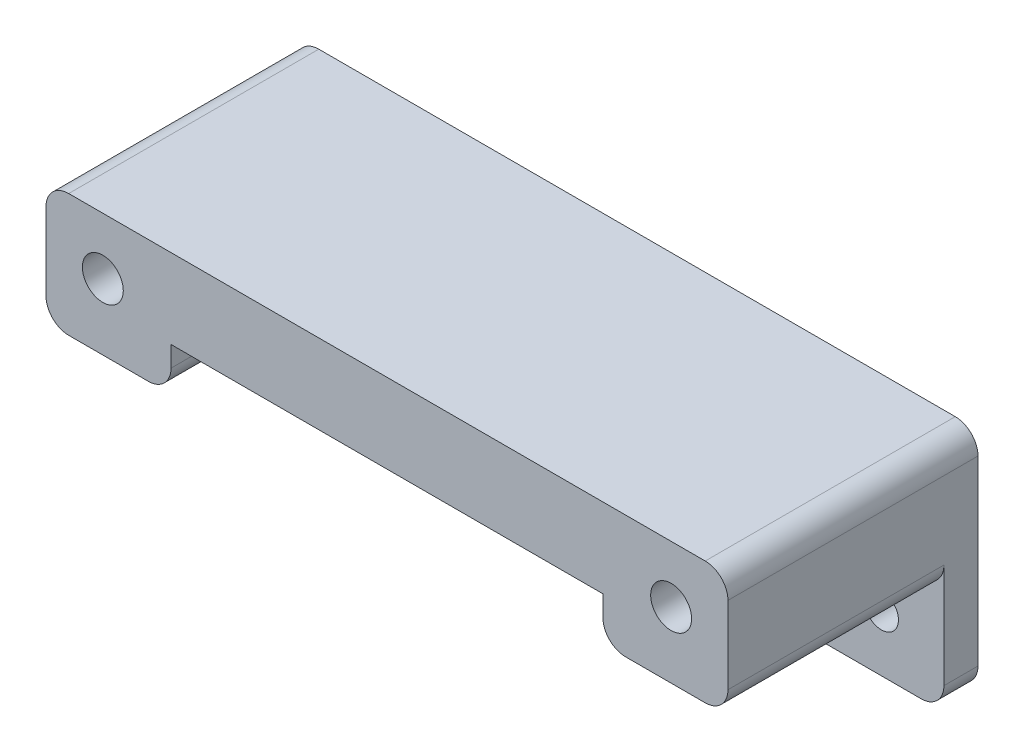
from build123d import *

# Parameters (mm, degrees)
SKETCH_1_W          = 60
SKETCH_1_H          = 20
SKETCH_1_R          = 1.5
EXTRUDE_2_DEPTH     = 3
EXTRUDE_3_DEPTH     = 19
SKETCH_3_R          = 1.8
CUT_EXTRUDE_1_DEPTH = 52.917907506
FILLET_1_R          = 2


with BuildPart() as part:
    # ｽｹｯﾁ1 → ﾎﾞｽ - 押し出し2 (new body)
    with BuildSketch(Plane.XY):
        with Locations((6.490384615, -19.663461538)):
            Rectangle(SKETCH_1_W, SKETCH_1_H)
        with Locations((30.990384615, -24.663461538)):
            Circle(SKETCH_1_R, mode=Mode.SUBTRACT)
        with Locations((-18.009615385, -24.663461538)):
            Circle(SKETCH_1_R, mode=Mode.SUBTRACT)
    extrude(amount=EXTRUDE_2_DEPTH)

    # ｽｹｯﾁ2 → ﾎﾞｽ - 押し出し3 (add)
    with BuildSketch(Plane.XY.offset(3)):
        Polygon((6.490384615, -16.663461538), (25.490384615, -16.663461538), (25.490384615, -20.47046126), (36.490384615, -20.47046126), (36.490384615, -9.663461538), (-23.509615385, -9.663461538), (-23.509615385, -20.47046126), (-12.509615385, -20.47046126), (-12.509615385, -16.663461538), align=None)
    extrude(amount=EXTRUDE_3_DEPTH)

    # ｽｹｯﾁ3 → ｶｯﾄ - 押し出し1 (cut, through all)
    with BuildSketch(Plane.XY.offset(22)):
        with Locations((31.490384615, -14.663461538)):
            Circle(SKETCH_3_R)
        with Locations((-18.509615385, -14.663461538)):
            Circle(SKETCH_3_R)
    extrude(amount=-CUT_EXTRUDE_1_DEPTH, mode=Mode.SUBTRACT)

    # ﾌｨﾚｯﾄ1
    fillet_1_edges = [part.edges().sort_by_distance(p)[0] for p in [
        (25.490384615, -20.47046126, 12.5),
        (36.490384615, -20.47046126, 12.5),
        (-23.509615385, -20.47046126, 12.5),
        (-12.509615385, -20.47046126, 12.5),
        (-23.509615385, -9.663461538, 11),
        (36.490384615, -9.663461538, 11),
        (36.490384615, -29.663461538, 1.5),
        (-23.509615385, -29.663461538, 1.5),
    ]]
    fillet(fillet_1_edges, radius=FILLET_1_R)


solid = part.part
